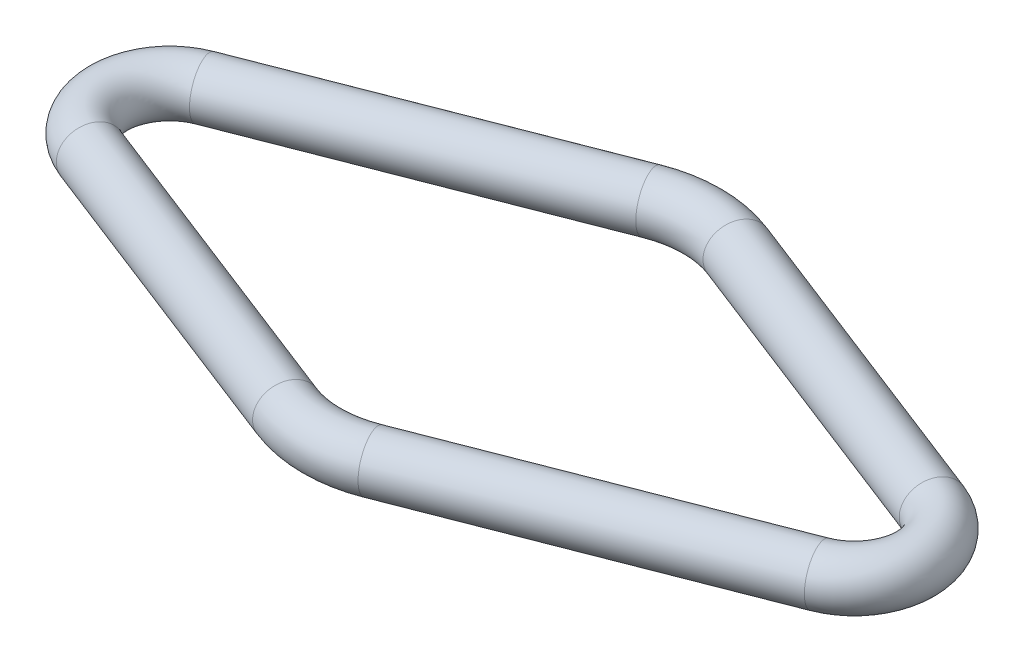
from build123d import *

# Parameters (mm, degrees)
DIA_R = 0.8


with BuildPart() as part:
    # O-Ring: sweep along a path in FlowPath
    with BuildLine(Plane(origin=(0, 0, 0), x_dir=(1, 0, 0), z_dir=(0, 1, 0))) as o_ring_path:
        Line((-11.020937583, -1.724048364), (-1.305608269, -5.504904924))
        ThreePointArc((-1.305608269, -5.504904924), (0, -5.75), (1.305608269, -5.504904924))
        Line((1.305608269, -5.504904924), (11.020937583, -1.724048364))
        ThreePointArc((11.020937583, -1.724048364), (12.2, 0), (11.020937583, 1.724048364))
        Line((11.020937583, 1.724048364), (1.305608269, 5.504904924))
        ThreePointArc((1.305608269, 5.504904924), (0, 5.75), (-1.305608269, 5.504904924))
        Line((-1.305608269, 5.504904924), (-11.020937583, 1.724048364))
        ThreePointArc((-11.020937583, 1.724048364), (-12.2, 0), (-11.020937583, -1.724048364))
    # Dia → O-Ring (sweep)
    with BuildSketch(Plane(origin=(-1.305608269, 0, 5.504904924), x_dir=(0.3626689636627123, 0, -0.9319180343763149), z_dir=(0.9319180343763149, 0, 0.3626689636627123))):
        Circle(DIA_R)
    sweep(path=o_ring_path.line)


solid = part.part
